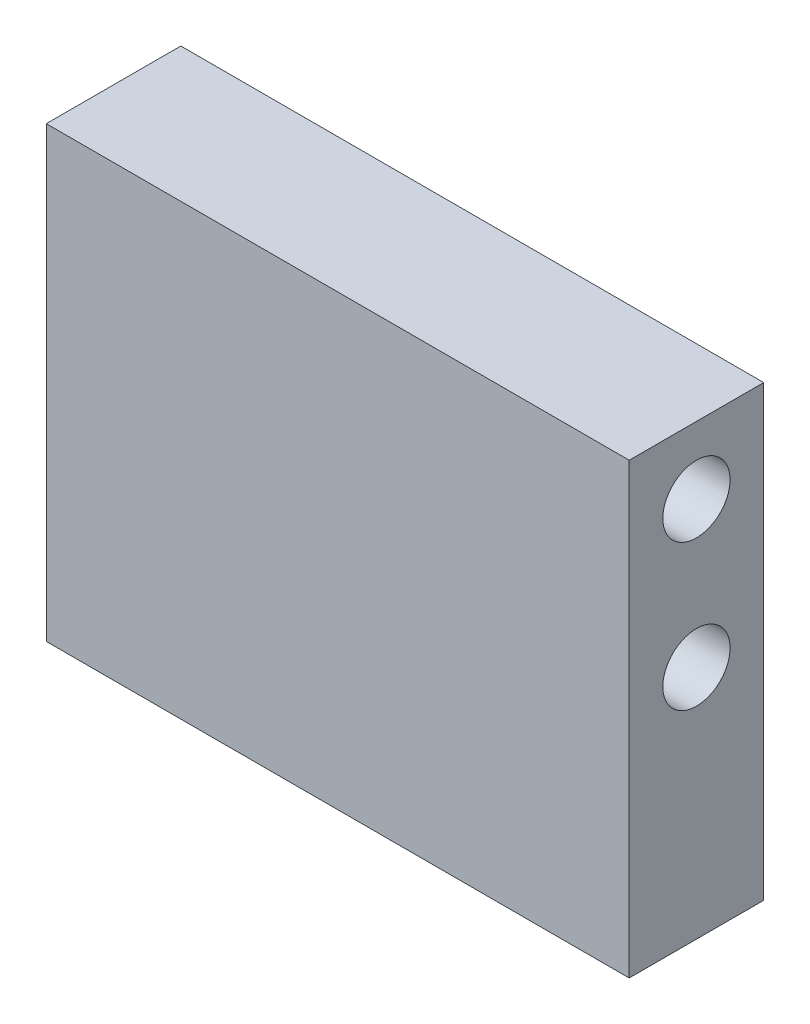
from build123d import *

# Parameters (mm, degrees)
SKETCH_1_W          = 52
SKETCH_1_H          = 40
EXTRUDE_1_DEPTH     = 12
SKETCH_2_R          = 3
CUT_EXTRUDE_1_DEPTH = 100


with BuildPart() as part:
    # 草图1 → 凸台-拉伸1 (new body)
    with BuildSketch(Plane.XY):
        Rectangle(SKETCH_1_W, SKETCH_1_H)
    extrude(amount=EXTRUDE_1_DEPTH)

    # 草图2 → 切除-拉伸1 (cut)
    with BuildSketch(Plane.ZY.offset(26)):
        with Locations((6, 14)):
            Circle(SKETCH_2_R)
        with Locations((6, 1)):
            Circle(SKETCH_2_R)
    extrude(amount=-CUT_EXTRUDE_1_DEPTH, mode=Mode.SUBTRACT)


solid = part.part
